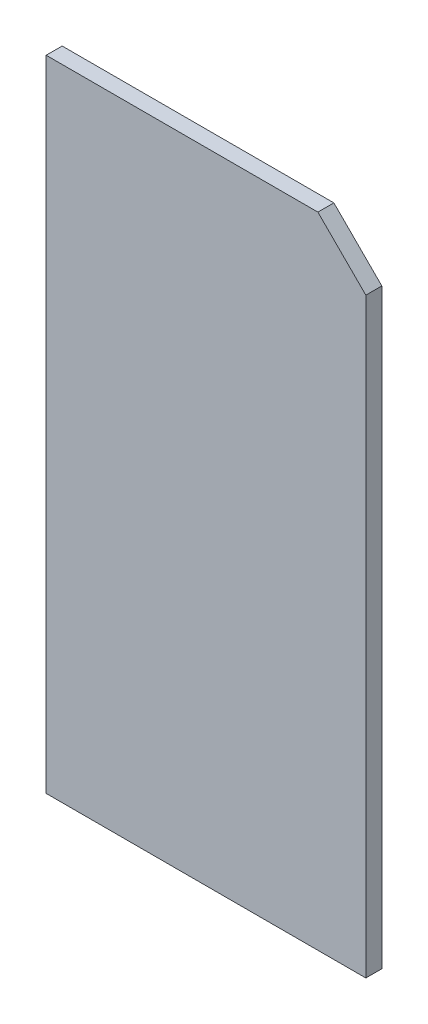
from build123d import *

# Parameters (mm, degrees)
SKETCH3_W           = 500
SKETCH3_H           = 1000
BOSS_EXTRUDE2_DEPTH = 25
CUT_EXTRUDE1_DEPTH  = 25.4


with BuildPart() as part:
    # Sketch3 → Boss-Extrude2 (new body)
    with BuildSketch(Plane.XY):
        Rectangle(SKETCH3_W, SKETCH3_H)
    extrude(amount=BOSS_EXTRUDE2_DEPTH)

    # Sketch4 → Cut-Extrude1 (cut)
    with BuildSketch(Plane.XY.offset(25)):
        Polygon((175, 500), (250, 425), (250, 500), align=None)
    extrude(amount=-CUT_EXTRUDE1_DEPTH, mode=Mode.SUBTRACT)


solid = part.part
